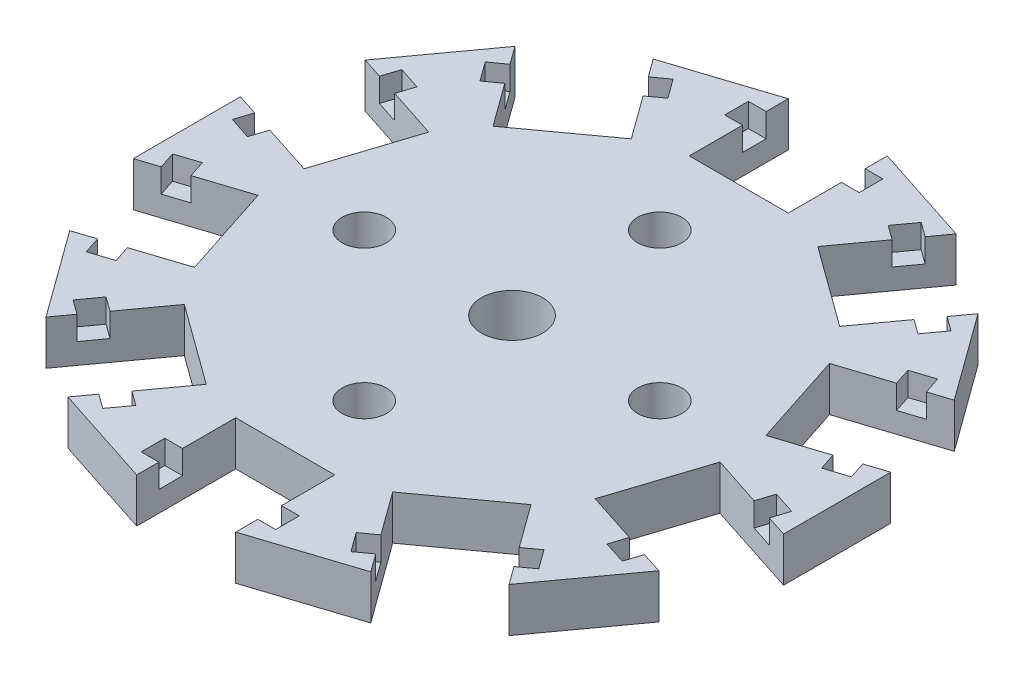
from build123d import *

# Parameters (mm, degrees)
BOSS_EXTRUDE1_DEPTH = 3
CUT_EXTRUDE1_DEPTH  = 3
SKETCH7_R           = 1.5
CUT_EXTRUDE3_DEPTH  = 3
SKETCH4_W           = 9.1
SKETCH4_H           = 1.6
CUT_EXTRUDE2_DEPTH  = 1.6
SKETCH10_R          = 2.075
CUT_EXTRUDE6_DEPTH  = 3


with BuildPart() as part:
    # Sketch1 → Boss-Extrude1 (new body)
    with BuildSketch(Plane(origin=(0, 0, 0), x_dir=(1, 0, 0), z_dir=(0, 1, 0))):
        Polygon((0, 23.132168933), (-13.596747752, 18.714317784), (-22, 7.148233317), (-22, -7.148233317), (-13.596747752, -18.714317784), (0, -23.132168933), (13.596747752, -18.714317784), (22, -7.148233317), (22, 7.148233317), (13.596747752, 18.714317784), align=None)
    extrude(amount=BOSS_EXTRUDE1_DEPTH)

    # Sketch2 → Cut-Extrude1 (cut)
    with BuildSketch(Plane(origin=(0, 3, 0), x_dir=(1, 0, 0), z_dir=(0, 1, 0))):
        Polygon((0, 23.132168933), (-3.35, 22.043687951), (-3.35, 15.343687951), (3.35, 15.343687951), (3.35, 22.043687951), align=None)
        Polygon((11.729000424, 10.444223713), (15.667161615, 15.864637576), (13.596747752, 18.714317784), (10.246747752, 19.802798766), (6.308586562, 14.382384904), align=None)
        Polygon((15.627921341, 1.555421004), (22, 3.625834866), (22, 7.148233317), (19.929586138, 9.997913525), (13.557507479, 7.927499663), align=None)
        Polygon((13.557507479, -7.927499663), (19.929586138, -9.997913525), (22, -7.148233317), (22, -3.625834866), (15.627921341, -1.555421004), align=None)
        Polygon((6.308586562, -14.382384904), (10.246747752, -19.802798766), (13.596747752, -18.714317784), (15.667161615, -15.864637576), (11.729000424, -10.444223713), align=None)
        Polygon((-3.35, -15.343687951), (-3.35, -22.043687951), (0, -23.132168933), (3.35, -22.043687951), (3.35, -15.343687951), align=None)
        Polygon((-11.729000424, -10.444223713), (-15.667161615, -15.864637576), (-13.596747752, -18.714317784), (-10.246747752, -19.802798766), (-6.308586562, -14.382384904), align=None)
        Polygon((-15.627921341, -1.555421004), (-22, -3.625834866), (-22, -7.148233317), (-19.929586138, -9.997913525), (-13.557507479, -7.927499663), align=None)
        Polygon((-13.557507479, 7.927499663), (-19.929586138, 9.997913525), (-22, 7.148233317), (-22, 3.625834866), (-15.627921341, 1.555421004), align=None)
        Polygon((-6.308586562, 14.382384904), (-10.246747752, 19.802798766), (-13.596747752, 18.714317784), (-15.667161615, 15.864637576), (-11.729000424, 10.444223713), align=None)
    extrude(amount=-CUT_EXTRUDE1_DEPTH, mode=Mode.SUBTRACT)

    # Sketch7 → Cut-Extrude3 (cut)
    with BuildSketch(Plane(origin=(0, 3, 0), x_dir=(1, 0, 0), z_dir=(0, 1, 0))):
        with Locations(Location((0, 10, 0), (0, 0, 270))):
            Circle(SKETCH7_R)
        with Locations(Location((10, 0, 0), (0, 0, 270))):
            Circle(SKETCH7_R)
        with Locations(Location((0, -10, 0), (0, 0, 270))):
            Circle(SKETCH7_R)
        with Locations(Location((-10, 0, 0), (0, 0, 270))):
            Circle(SKETCH7_R)
    extrude(amount=-CUT_EXTRUDE3_DEPTH, mode=Mode.SUBTRACT)

    # Sketch4 → Cut-Extrude2 (cut)
    with BuildSketch(Plane(origin=(0, 3, 0), x_dir=(1, 0, 0), z_dir=(0, 1, 0))):
        with Locations((0, 19.743687951)):
            Rectangle(SKETCH4_W, SKETCH4_H)
        Polygon((7.453793077, 18.000188386), (8.394249481, 19.294615577), (15.75630413, 13.945769781), (14.815847726, 12.65134259), align=None)
        Polygon((16.610490544, 10.181228662), (18.13218097, 10.675655853), (20.944235619, 2.021041555), (19.422545193, 1.526614364), align=None)
        Polygon((19.422545193, -1.526614364), (20.944235619, -2.021041555), (18.13218097, -10.675655853), (16.610490544, -10.181228662), align=None)
        Polygon((14.815847726, -12.65134259), (15.75630413, -13.945769781), (8.394249481, -19.294615577), (7.453793077, -18.000188386), align=None)
        with Locations((0, -19.743687951)):
            Rectangle(SKETCH4_W, SKETCH4_H)
        Polygon((-7.453793077, -18.000188386), (-8.394249481, -19.294615577), (-15.75630413, -13.945769781), (-14.815847726, -12.65134259), align=None)
        Polygon((-16.610490544, -10.181228662), (-18.13218097, -10.675655853), (-20.944235619, -2.021041555), (-19.422545193, -1.526614364), align=None)
        Polygon((-19.422545193, 1.526614364), (-20.944235619, 2.021041555), (-18.13218097, 10.675655853), (-16.610490544, 10.181228662), align=None)
        Polygon((-14.815847726, 12.65134259), (-15.75630413, 13.945769781), (-8.394249481, 19.294615577), (-7.453793077, 18.000188386), align=None)
    extrude(amount=-CUT_EXTRUDE2_DEPTH, mode=Mode.SUBTRACT)

    # Sketch10 → Cut-Extrude6 (cut)
    with BuildSketch(Plane.XZ):
        with Locations(Location((0, 0, 0), (0, 0, 270))):
            Circle(SKETCH10_R)
    extrude(amount=-CUT_EXTRUDE6_DEPTH, mode=Mode.SUBTRACT)


solid = part.part
